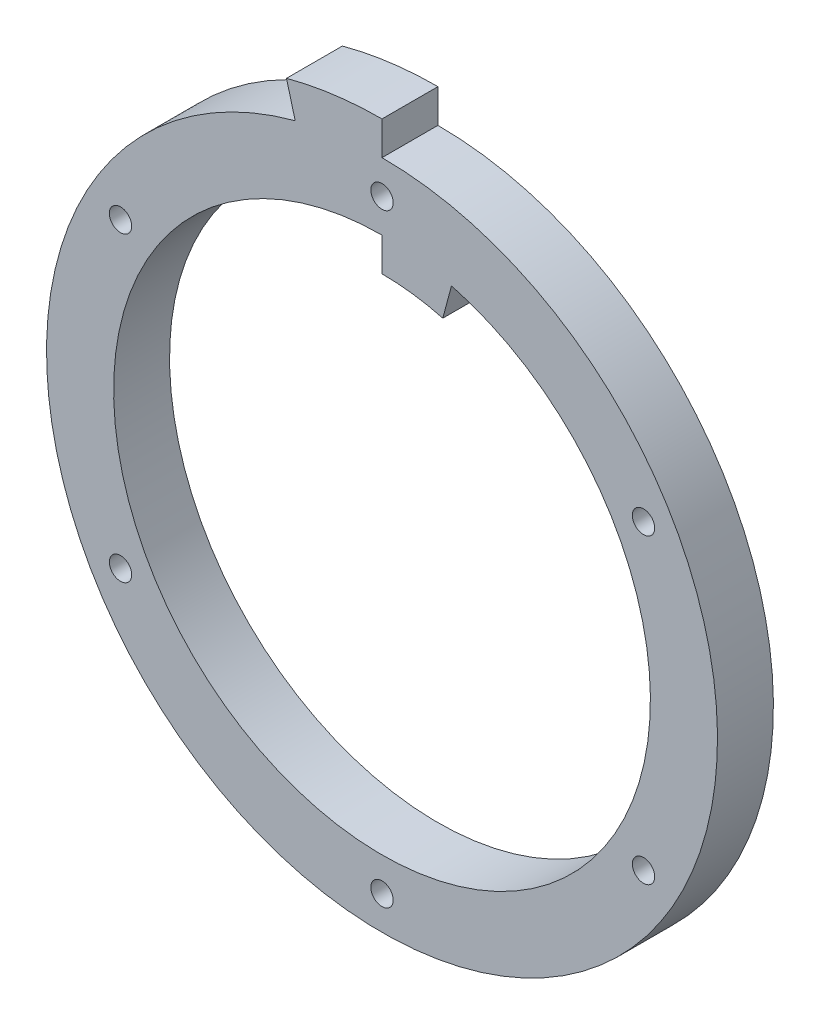
from build123d import *

# Parameters (mm, degrees)
SKETCH_1_R          = 30
SKETCH_1_R_2        = 24
EXTRUDE_1_DEPTH     = 5
SKETCH_2_R          = 1
CUT_EXTRUDE_1_DEPTH = 43.720018727
EXTRUDE_START       = -5
EXTRUDE_2_DEPTH     = 5


with BuildPart() as part:
    # 草图1 → 凸台-拉伸1 (new body)
    with BuildSketch(Plane.XY):
        Circle(SKETCH_1_R)
        Circle(SKETCH_1_R_2, mode=Mode.SUBTRACT)
    extrude(amount=EXTRUDE_1_DEPTH)

    # 草图2 → 切除-拉伸1 (cut, through all)
    with BuildSketch(Plane.XY.offset(5)):
        with Locations((0, 27)):
            Circle(SKETCH_2_R)
        with Locations((23.382685902, 13.5)):
            Circle(SKETCH_2_R)
        with Locations((23.382685902, -13.5)):
            Circle(SKETCH_2_R)
        with Locations((0, -27)):
            Circle(SKETCH_2_R)
        with Locations((-23.382685902, -13.5)):
            Circle(SKETCH_2_R)
        with Locations((-23.382685902, 13.5)):
            Circle(SKETCH_2_R)
    extrude(amount=-CUT_EXTRUDE_1_DEPTH, mode=Mode.SUBTRACT)

    # 草图3 → 凸台-拉伸2 (add)
    with BuildSketch(Plane.XY.offset(5).offset(EXTRUDE_START)):
        with BuildLine():
            Line((5.435199947, 20.284442352), (6.211657082, 23.182219831))
            ThreePointArc((6.211657082, 23.182219831), (3.132628613, 23.794676673), (0, 24))
            Line((0, 24), (0, 21))
            ThreePointArc((0, 21), (2.741050037, 20.820342089), (5.435199947, 20.284442352))
        make_face()
        with BuildLine():
            Line((0, 30), (0, 33))
            ThreePointArc((0, 33), (-4.307364343, 32.717680425), (-8.541028488, 31.875552268))
            Line((-8.541028488, 31.875552268), (-7.764571353, 28.977774789))
            ThreePointArc((-7.764571353, 28.977774789), (-3.915785767, 29.743345841), (0, 30))
        make_face()
    extrude(amount=EXTRUDE_2_DEPTH)


solid = part.part
